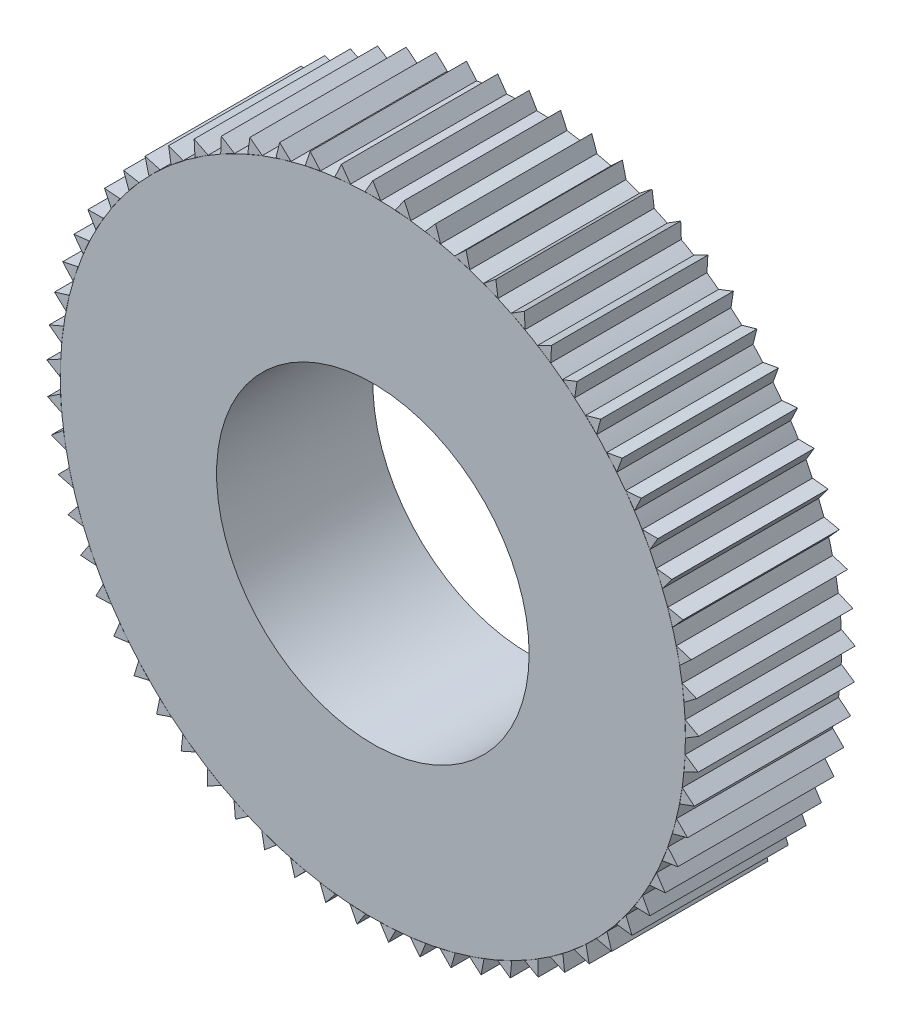
from build123d import *

# Parameters (mm, degrees)
SKETCH2_R           = 50
SKETCH2_R_2         = 25
BOSS_EXTRUDE1_DEPTH = 25
BOSS_EXTRUDE2_DEPTH = 25


with BuildPart() as part:
    # Sketch2 → Boss-Extrude1 (new body)
    with BuildSketch(Plane.XY):
        Circle(SKETCH2_R)
        with Locations((0, -0.896013923)):
            Circle(SKETCH2_R_2, mode=Mode.SUBTRACT)
    extrude(amount=BOSS_EXTRUDE1_DEPTH)


with BuildPart() as body_2:
    # Sketch3 → Boss-Extrude2 (new body)
    with BuildSketch(Plane.XY.offset(25)):
        Polygon((0, 50), (1.25, 50), (0, 52.165063509), (-1.25, 50), align=None)
        Polygon((5.034654814, 51.921537938), (6.069860589, 49.645939335), (4.825696046, 49.766581736), (3.581531502, 49.887224137), align=None)
        Polygon((10.022302413, 51.193234956), (10.833048525, 48.82834791), (9.606335868, 49.068506307), (8.37962321, 49.308664704), align=None)
        Polygon((14.916374474, 49.986954533), (15.495091206, 47.554859357), (14.29728392, 47.912291455), (13.099476634, 48.269723553), align=None)
        Polygon((19.671176366, 48.313959384), (20.012460396, 45.837363896), (18.854742084, 46.308732448), (17.697023773, 46.780101), align=None)
        Polygon((24.242313784, 46.189869813), (24.342978634, 43.691897318), (23.236158602, 44.272801283), (22.12933857, 44.853705248), align=None)
        Polygon((28.58710725, 43.634517873), (28.44621304, 41.138491266), (27.400625368, 41.823506901), (26.355037695, 42.508522535), align=None)
        Polygon((32.664990598, 40.671762196), (32.283852819, 38.200986206), (31.309259877, 38.983717703), (30.334666934, 39.7664492), align=None)
        Polygon((36.43788973, 37.329265235), (35.820066963, 34.906808831), (34.925568262, 35.779948037), (34.031069562, 36.653087244), align=None)
        Polygon((39.870578104, 33.638234981), (39.021838793, 31.286715986), (38.215786027, 32.242110637), (37.409733261, 33.197505287), align=None)
        Polygon((42.931005632, 29.633133591), (41.859274228, 27.374507504), (41.149193295, 28.403237337), (40.439112361, 29.431967169), align=None)
        Polygon((45.590597927, 25.351355616), (44.305880898, 23.206710621), (43.698401631, 24.299170662), (43.090922365, 25.391630703), align=None)
        Polygon((47.824523094, 20.832878865), (46.338815495, 18.822238934), (45.839609766, 19.968229178), (45.340404036, 21.114219422), align=None)
        Polygon((49.611923574, 16.119891137), (47.939097058, 14.262029073), (47.552825815, 15.450849719), (47.166554572, 16.639670364), align=None)
        Polygon((50.93611089, 11.256396329), (49.091784187, 9.56865849), (48.822053941, 10.789209838), (48.552323696, 12.009761187), align=None)
        Polygon((51.784721464, 6.287803581), (49.786114555, 4.78594792), (49.635443705, 6.026834013), (49.484772855, 7.267720105), align=None)
        Polygon((52.149832045, 1.260503305), (50.015605386, -0.041447756), (49.985400704, 1.208187262), (49.955196022, 2.457822279), align=None)
        Polygon((52.028033696, -3.778565951), (49.778113984, -4.868456445), (49.868657485, -3.621740008), (49.959200985, -2.375023571), align=None)
        Polygon((51.420463615, -8.782355754), (49.075857745, -9.650009669), (49.286304047, -8.417852067), (49.496750348, -7.185694466), align=None)
        Polygon((50.332794519, -13.704147068), (47.915393444, -14.341463352), (48.243777667, -13.13536891), (48.57216189, -11.929274468), align=None)
        Polygon((48.775181682, -18.497986453), (46.307556025, -18.899014655), (46.750812134, -17.730244352), (47.194068243, -16.561474049), align=None)
        Polygon((46.762168116, -23.119115123), (44.267357433, -23.280110952), (44.821346865, -22.15957728), (45.375336297, -21.039043608), align=None)
        Polygon((44.312548785, -27.524386844), (41.813846451, -27.443847124), (42.473396756, -26.382012205), (43.132947061, -25.320177286), align=None)
        Polygon((41.449195125, -31.672670781), (38.969930851, -31.351347491), (39.728883986, -30.358125391), (40.48783712, -29.364903291), align=None)
        Polygon((38.198841499, -35.525235525), (35.762163506, -34.966128773), (36.61343333, -34.050792939), (37.464703153, -33.135457106), align=None)
        Polygon((34.591835582, -39.046110716), (32.220494477, -38.254440731), (33.156132912, -37.425537409), (34.091771347, -36.596634086), align=None)
        Polygon((30.661855016, -42.202422892), (28.377991372, -41.185581284), (29.389262615, -40.450849719), (30.400533858, -39.716118153), align=None)
        Polygon((26.445592971, -44.964702416), (24.270530607, -43.732183161), (25.347992691, -43.098483344), (26.425454774, -42.464783527), align=None)
        Polygon((21.98241555, -47.307158629), (19.936462438, -45.870469427), (21.070055389, -45.343718043), (22.20364834, -44.816966658), align=None)
        Polygon((17.313994238, -49.207920648), (15.41625289, -47.580475479), (16.595392656, -47.165590663), (17.774532423, -46.750705846), align=None)
        Polygon((12.483916826, -50.64924157), (10.752105943, -48.846235452), (11.965783214, -48.547090871), (13.179460486, -48.247946291), align=None)
        Polygon((7.537280447, -51.61766417), (5.987569479, -49.655931285), (7.224452478, -49.475319973), (8.461335478, -49.294708661), align=None)
        Polygon((2.520270511, -52.104146548), (1.167128693, -50.002003066), (2.415668976, -49.941611342), (3.66420926, -49.881219617), align=None)
        Polygon((-2.520270511, -52.104146548), (-3.66420926, -49.881219617), (-2.415668976, -49.941611342), (-1.167128693, -50.002003066), align=None)
        Polygon((-7.537280447, -51.61766417), (-8.461335478, -49.294708661), (-7.224452478, -49.475319973), (-5.987569479, -49.655931285), align=None)
        Polygon((-12.483916826, -50.64924157), (-13.179460486, -48.247946291), (-11.965783214, -48.547090871), (-10.752105943, -48.846235452), align=None)
        Polygon((-17.313994238, -49.207920648), (-17.774532423, -46.750705846), (-16.595392656, -47.165590663), (-15.41625289, -47.580475479), align=None)
        Polygon((-21.98241555, -47.307158629), (-22.20364834, -44.816966658), (-21.070055389, -45.343718043), (-19.936462438, -45.870469427), align=None)
        Polygon((-26.445592971, -44.964702416), (-26.425454774, -42.464783527), (-25.347992691, -43.098483344), (-24.270530607, -43.732183161), align=None)
        Polygon((-30.661855016, -42.202422892), (-30.400533858, -39.716118153), (-29.389262615, -40.450849719), (-28.377991372, -41.185581284), align=None)
        Polygon((-34.591835582, -39.046110716), (-34.091771347, -36.596634086), (-33.156132912, -37.425537409), (-32.220494477, -38.254440731), align=None)
        Polygon((-38.198841499, -35.525235525), (-37.464703153, -33.135457106), (-36.61343333, -34.050792939), (-35.762163506, -34.966128773), align=None)
        Polygon((-41.449195125, -31.672670781), (-40.48783712, -29.364903291), (-39.728883986, -30.358125391), (-38.969930851, -31.351347491), align=None)
        Polygon((-44.312548785, -27.524386844), (-43.132947061, -25.320177286), (-42.473396756, -26.382012205), (-41.813846451, -27.443847124), align=None)
        Polygon((-46.762168116, -23.119115123), (-45.375336297, -21.039043608), (-44.821346865, -22.15957728), (-44.267357433, -23.280110952), align=None)
        Polygon((-48.775181682, -18.497986453), (-47.194068243, -16.561474049), (-46.750812134, -17.730244352), (-46.307556025, -18.899014655), align=None)
        Polygon((-50.332794519, -13.704147068), (-48.57216189, -11.929274468), (-48.243777667, -13.13536891), (-47.915393444, -14.341463352), align=None)
        Polygon((-51.420463615, -8.782355754), (-49.496750348, -7.185694466), (-49.286304047, -8.417852067), (-49.075857745, -9.650009669), align=None)
        Polygon((-52.028033696, -3.778565951), (-49.959200985, -2.375023571), (-49.868657485, -3.621740008), (-49.778113984, -4.868456445), align=None)
        Polygon((-52.149832045, 1.260503305), (-49.955196022, 2.457822279), (-49.985400704, 1.208187262), (-50.015605386, -0.041447756), align=None)
        Polygon((-51.784721464, 6.287803581), (-49.484772855, 7.267720105), (-49.635443705, 6.026834013), (-49.786114555, 4.78594792), align=None)
        Polygon((-50.93611089, 11.256396329), (-48.552323696, 12.009761187), (-48.822053941, 10.789209838), (-49.091784187, 9.56865849), align=None)
        Polygon((-49.611923574, 16.119891137), (-47.166554572, 16.639670364), (-47.552825815, 15.450849719), (-47.939097058, 14.262029073), align=None)
        Polygon((-47.824523094, 20.832878865), (-45.340404036, 21.114219422), (-45.839609766, 19.968229178), (-46.338815495, 18.822238934), align=None)
        Polygon((-45.590597927, 25.351355616), (-43.090922365, 25.391630703), (-43.698401631, 24.299170662), (-44.305880898, 23.206710621), align=None)
        Polygon((-42.931005632, 29.633133591), (-40.439112361, 29.431967169), (-41.149193295, 28.403237337), (-41.859274228, 27.374507504), align=None)
        Polygon((-39.870578104, 33.638234981), (-37.409733261, 33.197505287), (-38.215786027, 32.242110637), (-39.021838793, 31.286715986), align=None)
        Polygon((-36.43788973, 37.329265235), (-34.031069562, 36.653087244), (-34.925568262, 35.779948037), (-35.820066963, 34.906808831), align=None)
        Polygon((-32.664990598, 40.671762196), (-30.334666934, 39.7664492), (-31.309259877, 38.983717703), (-32.283852819, 38.200986206), align=None)
        Polygon((-28.58710725, 43.634517873), (-26.355037695, 42.508522535), (-27.400625368, 41.823506901), (-28.44621304, 41.138491266), align=None)
        Polygon((-24.242313784, 46.189869813), (-22.12933857, 44.853705248), (-23.236158602, 44.272801283), (-24.342978634, 43.691897318), align=None)
        Polygon((-19.671176366, 48.313959384), (-17.697023773, 46.780101), (-18.854742084, 46.308732448), (-20.012460396, 45.837363896), align=None)
        Polygon((-14.916374474, 49.986954533), (-13.099476634, 48.269723553), (-14.29728392, 47.912291455), (-15.495091206, 47.554859357), align=None)
        Polygon((-10.022302413, 51.193234956), (-8.37962321, 49.308664704), (-9.606335868, 49.068506307), (-10.833048525, 48.82834791), align=None)
        Polygon((-5.034654814, 51.921537938), (-3.581531502, 49.887224137), (-4.825696046, 49.766581736), (-6.069860589, 49.645939335), align=None)
    extrude(amount=-BOSS_EXTRUDE2_DEPTH)


solid = Compound([part.part, body_2.part])
